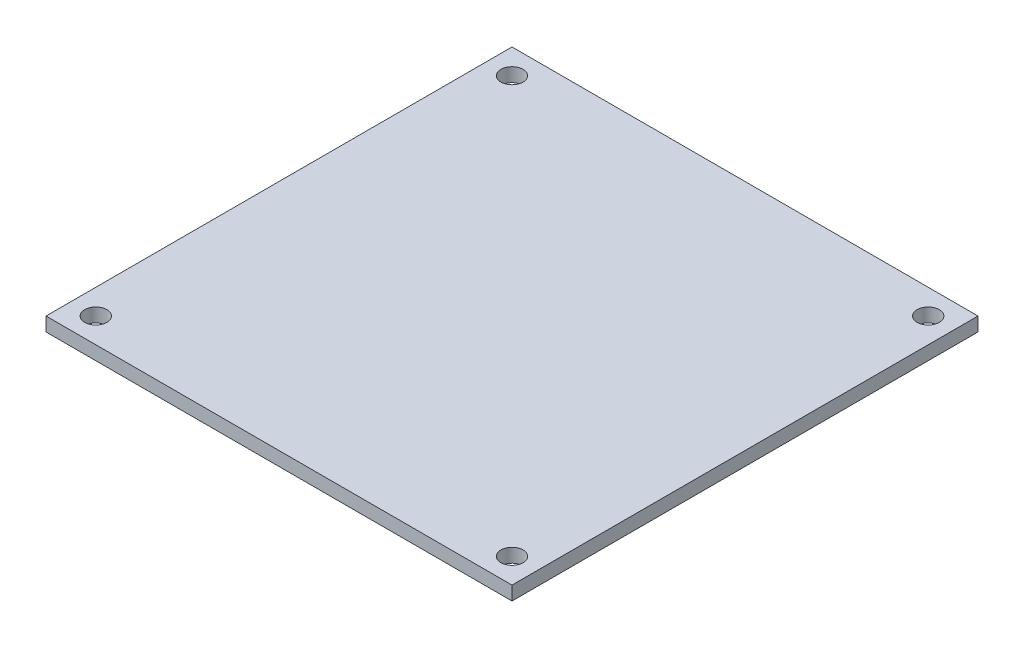
from build123d import *

# Parameters (mm, degrees)
SKETCH1_W           = 84.193735112
SKETCH1_H           = 84.193735112
SKETCH1_R           = 2
BOSS_EXTRUDE1_DEPTH = 2.5


with BuildPart() as part:
    # Sketch1 → Boss-Extrude1 (new body)
    with BuildSketch(Plane(origin=(0, 0, 0), x_dir=(1, 0, 0), z_dir=(0, 1, 0))):
        Rectangle(SKETCH1_W, SKETCH1_H)
        with Locations(Location((37.596867556, 37.596867556, 0), (0, 0, 270))):
            Circle(SKETCH1_R, mode=Mode.SUBTRACT)
        with Locations(Location((-37.596867556, 37.596867556, 0), (0, 0, 90))):
            Circle(SKETCH1_R, mode=Mode.SUBTRACT)
        with Locations(Location((-37.596867556, -37.596867556, 0), (0, 0, 270))):
            Circle(SKETCH1_R, mode=Mode.SUBTRACT)
        with Locations(Location((37.596867556, -37.596867556, 0), (0, 0, 90))):
            Circle(SKETCH1_R, mode=Mode.SUBTRACT)
    extrude(amount=BOSS_EXTRUDE1_DEPTH)


solid = part.part
